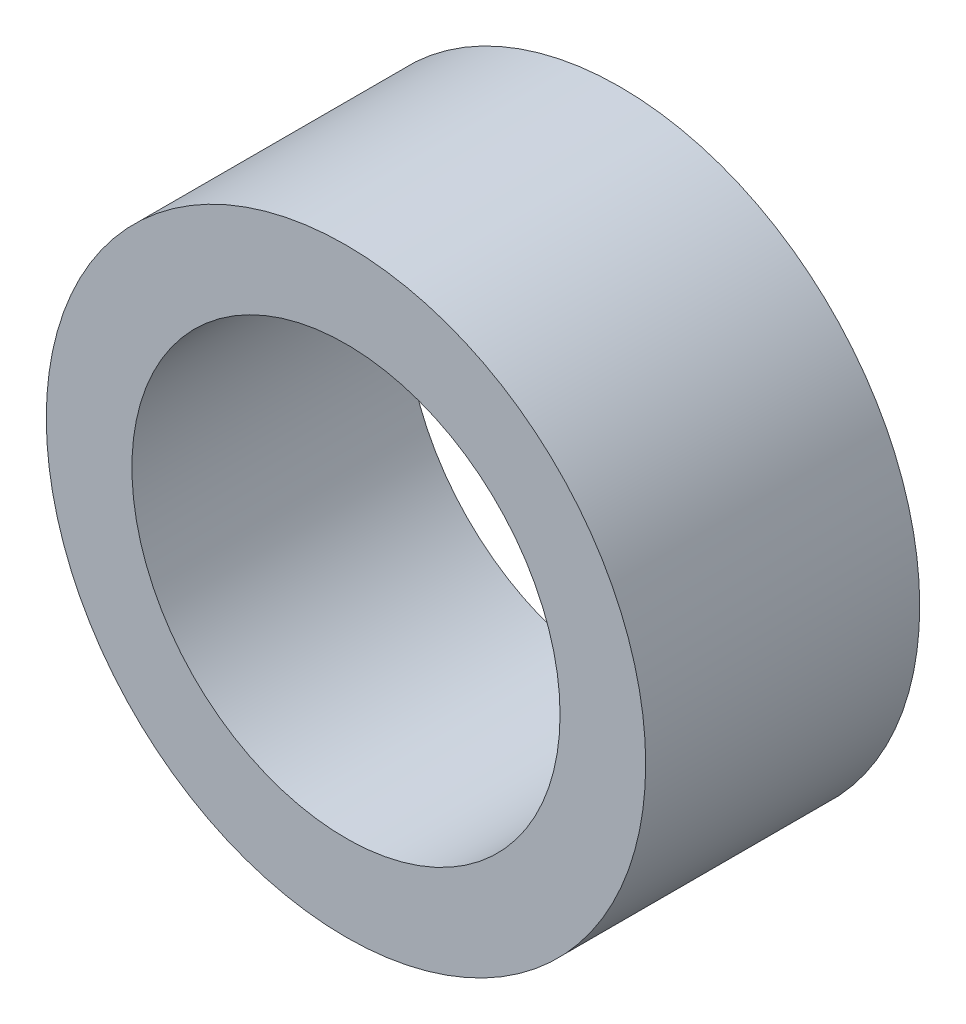
from build123d import *

# Parameters (mm, degrees)
SKETCH1_R           = 4.445
SKETCH1_R_2         = 3.175
BOSS_EXTRUDE1_DEPTH = 6.985
CUT_EXTRUDE1_START  = -2.921
SKETCH2_R           = 4.445
CUT_EXTRUDE1_DEPTH  = 2.921


with BuildPart() as part:
    # Sketch1 → Boss-Extrude1 (new body)
    with BuildSketch(Plane.XY):
        Circle(SKETCH1_R)
        Circle(SKETCH1_R_2, mode=Mode.SUBTRACT)
    extrude(amount=BOSS_EXTRUDE1_DEPTH)

    # Sketch2 → Cut-Extrude1 (cut)
    with BuildSketch(Plane.XY.offset(6.985).offset(CUT_EXTRUDE1_START)):
        Circle(SKETCH2_R)
    extrude(amount=CUT_EXTRUDE1_DEPTH, mode=Mode.SUBTRACT)


solid = part.part
